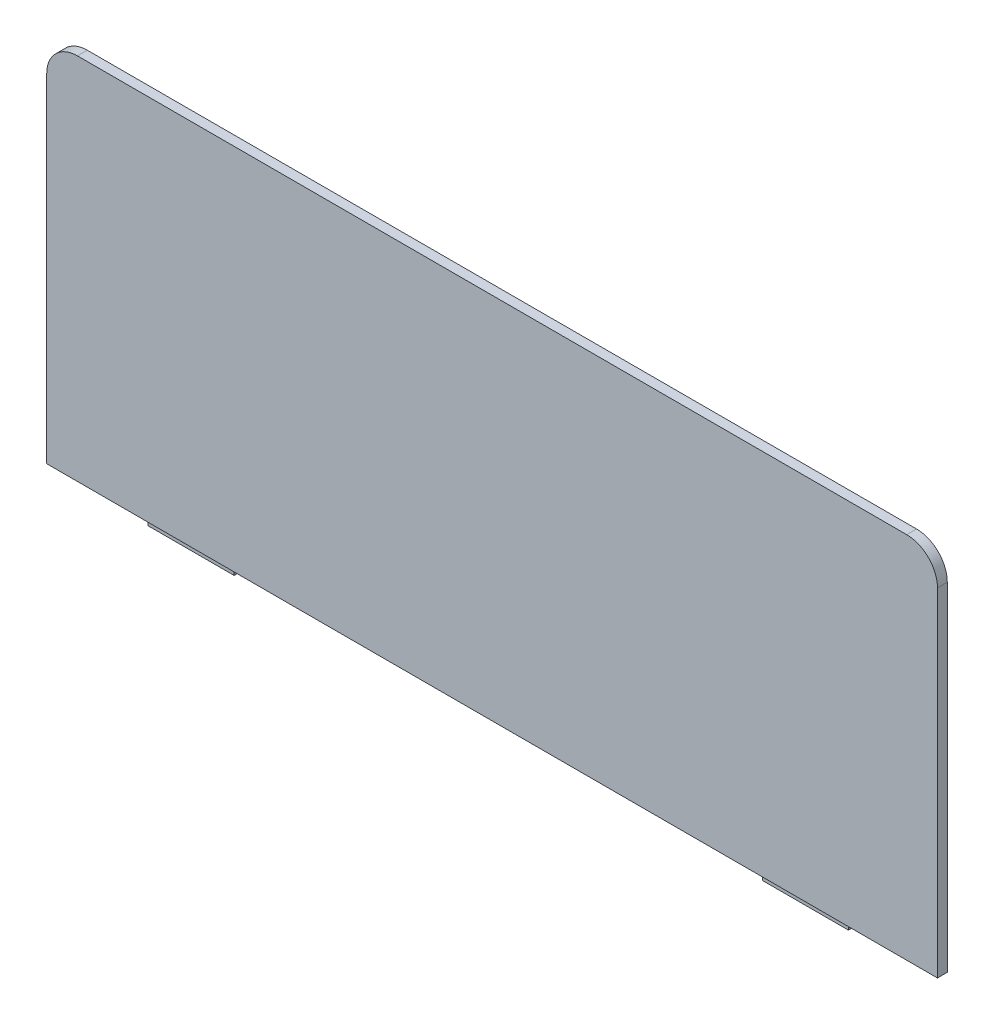
from build123d import *

# Parameters (mm, degrees)
EXTRUDE_1_DEPTH     = 3.2
SKETCH_2_W          = 28
SKETCH_2_H          = 3
CUT_EXTRUDE_1_DEPTH = 2
SKETCH_3_W          = 5
SKETCH_3_H          = 12
EXTRUDE_2_DEPTH     = 7
SKETCH_4_R          = 1
CUT_EXTRUDE_2_DEPTH = 243.070789578


with BuildPart() as part:
    # 草图1 → 凸台-拉伸1 (new body)
    with BuildSketch(Plane.XY):
        with BuildLine():
            Line((-107.202531646, -47.623114492), (64.797468354, -47.623114492))
            Line((64.797468354, -47.623114492), (64.797468354, -50.623114492))
            Line((64.797468354, -50.623114492), (92.797468354, -50.623114492))
            Line((92.797468354, -50.623114492), (92.797468354, -47.623114492))
            Line((92.797468354, -47.623114492), (123.797468354, -47.623114492))
            Line((123.797468354, -47.623114492), (123.797468354, 62.376885508))
            ThreePointArc((123.797468354, 62.376885508), (120.868536166, 69.447953319), (113.797468354, 72.376885508))
            Line((113.797468354, 72.376885508), (-156.202531646, 72.376885508))
            ThreePointArc((-156.202531646, 72.376885508), (-163.273599457, 69.447953319), (-166.202531646, 62.376885508))
            Line((-166.202531646, 62.376885508), (-166.202531646, -47.623114492))
            Line((-166.202531646, -47.623114492), (-135.202531646, -47.623114492))
            Line((-135.202531646, -47.623114492), (-135.202531646, -50.623114492))
            Line((-135.202531646, -50.623114492), (-107.202531646, -50.623114492))
            Line((-107.202531646, -50.623114492), (-107.202531646, -47.623114492))
        make_face()
    extrude(amount=EXTRUDE_1_DEPTH)

    # 草图2 → 切除-拉伸1 (cut)
    with BuildSketch(Plane.XY.offset(3.2)):
        with Locations((-121.202531646, -49.123114492)):
            Rectangle(SKETCH_2_W, SKETCH_2_H)
        with Locations((78.797468354, -49.123114492)):
            Rectangle(SKETCH_2_W, SKETCH_2_H)
    extrude(amount=-CUT_EXTRUDE_1_DEPTH, mode=Mode.SUBTRACT)

    # 草图3 → 凸台-拉伸2 (add)
    with BuildSketch(Plane.XY):
        with Locations((-129.902531646, 13.376885508)):
            Rectangle(SKETCH_3_W, SKETCH_3_H)
        with Locations((87.497468354, 13.376885508)):
            Rectangle(SKETCH_3_W, SKETCH_3_H)
    extrude(amount=-EXTRUDE_2_DEPTH)

    # 草图4 → 切除-拉伸2 (cut, through all)
    with BuildSketch(Plane(origin=(65.420582847, 19.376885508, 0), x_dir=(0, 0, -1), z_dir=(0, -1, 0))):
        with Locations(Location((4.5, -195.323114492, 0), (0, 0, 90))):
            Circle(SKETCH_4_R)
        with Locations(Location((4.5, 22.076885508, 0), (0, 0, 90))):
            Circle(SKETCH_4_R)
    extrude(amount=CUT_EXTRUDE_2_DEPTH, mode=Mode.SUBTRACT)


solid = part.part
